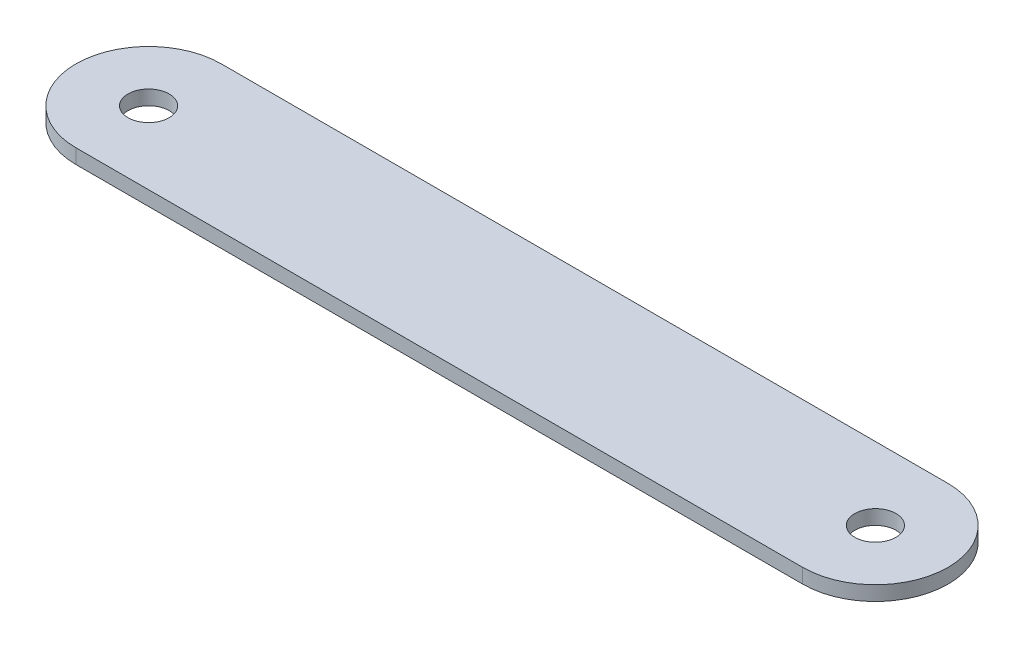
from build123d import *

# Parameters (mm, degrees)
RESSALTO_EXTRUS_O2_DEPTH = 3
ESBO_O4_R                = 4.25
CORTE_EXTRUS_O1_DEPTH    = 10


with BuildPart() as part:
    # Esboço3 → Ressalto-extrusão2 (new body)
    with BuildSketch(Plane(origin=(0, 0, 0), x_dir=(1, 0, 0), z_dir=(0, 1, 0))):
        with BuildLine():
            Line((-50, 15), (100, 15))
            ThreePointArc((100, 15), (115, 0), (100, -15))
            Line((100, -15), (-50, -15))
            ThreePointArc((-50, -15), (-65, 0), (-50, 15))
        make_face()
    extrude(amount=RESSALTO_EXTRUS_O2_DEPTH)

    # Esboço4 → Corte-extrusão1 (cut)
    with BuildSketch(Plane(origin=(0, 3, 0), x_dir=(1, 0, 0), z_dir=(0, 1, 0))):
        with Locations(Location((-50, 0, 0), (0, 0, 270))):
            Circle(ESBO_O4_R)
        with Locations(Location((100, 0, 0), (0, 0, 90))):
            Circle(ESBO_O4_R)
    extrude(amount=-CORTE_EXTRUS_O1_DEPTH, mode=Mode.SUBTRACT)


solid = part.part
